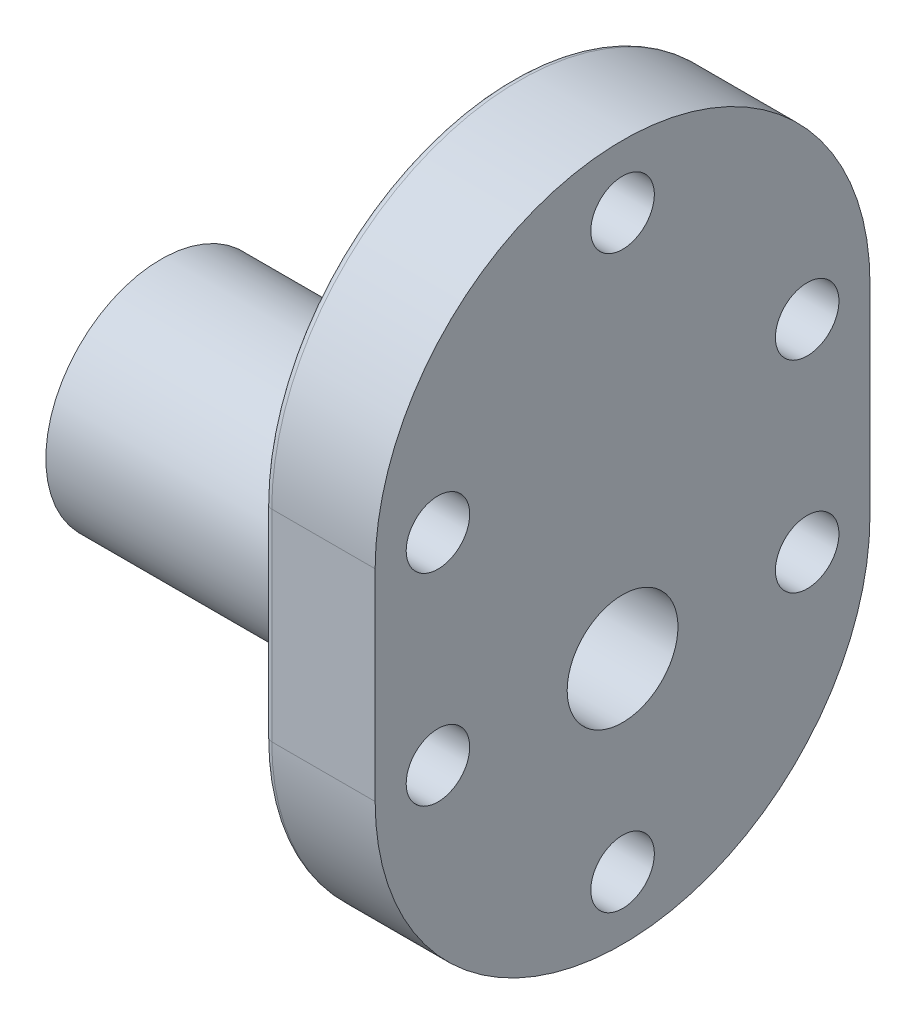
from build123d import *

# Parameters (mm, degrees)
BOSS_EXTRUDE1_DEPTH              = 38.1
SKETCH2_R                        = 39.62
BOSS_EXTRUDE2_DEPTH              = 120.65
F_1_16_1_25_DIAMETER_HOLE1_D     = 31.75
F_1_16_1_25_DIAMETER_HOLE1_DEPTH = 71.94630657
F_1_16_1_25_DIAMETER_HOLE1_TIP   = 4.25369343
SKETCH4_R                        = 19.05
CUT_EXTRUDE1_DEPTH               = 238.253258987
FILLET1_R                        = 3.81
SKETCH6_R                        = 10.922
CUT_EXTRUDE2_DEPTH               = 214.644491855
FILLET2_R                        = 2.54
F_1_16_2_5_DIAMETER_HOLE1_D      = 63.5
F_1_16_2_5_DIAMETER_HOLE1_DEPTH  = 67.69261314
F_1_16_2_5_DIAMETER_HOLE1_TIP    = 8.50738686


with BuildPart() as part:
    # Sketch1 → Boss-Extrude1 (new body)
    with BuildSketch(Plane(origin=(0, 0, 0), x_dir=(0, 0, -1), z_dir=(1, 0, 0))):
        with BuildLine():
            Line((-85.1, 69.32), (-85.1, 0))
            ThreePointArc((-85.1, 0), (0, -85.1), (85.1, 0))
            Line((85.1, 0), (85.1, 69.32))
            ThreePointArc((85.1, 69.32), (0, 154.42), (-85.1, 69.32))
        make_face()
    extrude(amount=-BOSS_EXTRUDE1_DEPTH)

    # Sketch2 → Boss-Extrude2 (add)
    with BuildSketch(Plane.ZY.offset(38.1)):
        with Locations(Location((0, 0, 0), (0, 0, 180))):
            Circle(SKETCH2_R)
    extrude(amount=BOSS_EXTRUDE2_DEPTH)

    # 1/16 (1.25) Diameter Hole1
    with Locations(Plane(origin=(-158.75, 0, 0), x_dir=(0, 0, -1), z_dir=(-1, 0, 0))):
        with Locations((0, 0)):
            Hole(F_1_16_1_25_DIAMETER_HOLE1_D / 2, depth=F_1_16_1_25_DIAMETER_HOLE1_DEPTH)
            with Locations((0, 0, -(F_1_16_1_25_DIAMETER_HOLE1_DEPTH + F_1_16_1_25_DIAMETER_HOLE1_TIP / 2))):  # 150° drill point
                Cone(0, F_1_16_1_25_DIAMETER_HOLE1_D / 2, F_1_16_1_25_DIAMETER_HOLE1_TIP, mode=Mode.SUBTRACT)

    # Sketch4 → Cut-Extrude1 (cut, through all)
    with BuildSketch(Plane.ZY.offset(158.75)):
        Circle(SKETCH4_R)
    extrude(amount=-CUT_EXTRUDE1_DEPTH, mode=Mode.SUBTRACT)

    # Fillet1
    fillet1_edges = [part.edges().sort_by_distance(p)[0] for p in [
        (-38.1, 0, 39.62),
    ]]
    fillet(fillet1_edges, radius=FILLET1_R)

    # Sketch6 → Cut-Extrude2 (cut, through all)
    with BuildSketch(Plane.ZY.offset(38.1)):
        with Locations((0, 132.831)):
            Circle(SKETCH6_R)
        with Locations((63.5, 69.331)):
            Circle(SKETCH6_R)
        with Locations((-63.5, 69.331)):
            Circle(SKETCH6_R)
        with Locations((63.5, -0.011)):
            Circle(SKETCH6_R)
        with Locations((0, -63.511)):
            Circle(SKETCH6_R)
        with Locations((-63.5, -0.011)):
            Circle(SKETCH6_R)
    extrude(amount=-CUT_EXTRUDE2_DEPTH, mode=Mode.SUBTRACT)

    # Fillet2
    fillet2_edges = [part.edges().sort_by_distance(p)[0] for p in [
        (-38.1, -85.1, 0),
        (-38.1, 34.66, -85.1),
        (-38.1, 154.42, 0),
        (-38.1, 34.66, 85.1),
    ]]
    fillet(fillet2_edges, radius=FILLET2_R)

    # 1/16 (2.5) Diameter Hole1
    with Locations(Plane(origin=(-158.75, 0, 0), x_dir=(0, 0, -1), z_dir=(-1, 0, 0))):
        with Locations((0, 0)):
            Hole(F_1_16_2_5_DIAMETER_HOLE1_D / 2, depth=F_1_16_2_5_DIAMETER_HOLE1_DEPTH)
            with Locations((0, 0, -(F_1_16_2_5_DIAMETER_HOLE1_DEPTH + F_1_16_2_5_DIAMETER_HOLE1_TIP / 2))):  # 150° drill point
                Cone(0, F_1_16_2_5_DIAMETER_HOLE1_D / 2, F_1_16_2_5_DIAMETER_HOLE1_TIP, mode=Mode.SUBTRACT)


solid = part.part
